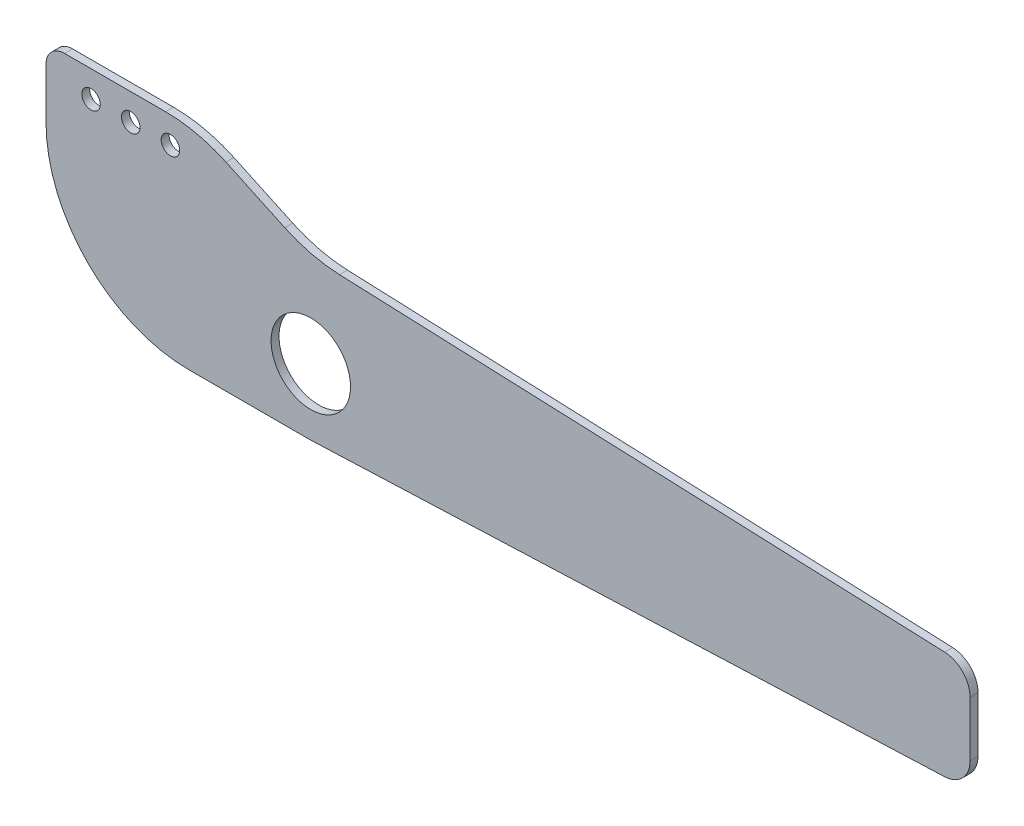
from build123d import *

# Parameters (mm, degrees)
BOSS_EXTRU_1_DEPTH      = 3
ESQUISSE2_R             = 15
ENL_V_MAT_EXTRU_1_DEPTH = 3
ESQUISSE3_W             = 100
ESQUISSE3_H             = 3
BOSS_EXTRU_2_DEPTH      = 20
ESQUISSE4_R             = 3.5
ENL_V_MAT_EXTRU_2_DEPTH = 3
ENL_V_MAT_EXTRU_3_DEPTH = 3
CONG_1_R                = 54
CONG_3_R                = 54
CONG_4_R                = 10
CONG_5_R                = 7


with BuildPart() as part:
    # Esquisse1 → Boss.-Extru.1 (new body)
    with BuildSketch(Plane.XY):
        Polygon((0, 0), (0, 60), (100, 60), (348.978261886, 50), (348.978261886, 10), (100, 0), align=None)
    extrude(amount=BOSS_EXTRU_1_DEPTH)

    # Esquisse2 → Enlèv. mat.-Extru.1 (cut)
    with BuildSketch(Plane.XY.offset(3)):
        with Locations((100, 25)):
            Circle(ESQUISSE2_R)
    extrude(amount=-ENL_V_MAT_EXTRU_1_DEPTH, mode=Mode.SUBTRACT)

    # Esquisse3 → Boss.-Extru.2 (add)
    with BuildSketch(Plane(origin=(0, 60, 0), x_dir=(1, 0, 0), z_dir=(0, 1, 0))):
        with Locations((50, -1.5)):
            Rectangle(ESQUISSE3_W, ESQUISSE3_H)
    extrude(amount=BOSS_EXTRU_2_DEPTH)

    # Esquisse4 → Enlèv. mat.-Extru.2 (cut)
    with BuildSketch(Plane.XY.offset(3)):
        with Locations((47, 70)):
            Circle(ESQUISSE4_R)
        with Locations((32, 70)):
            Circle(ESQUISSE4_R)
        with Locations((17, 70)):
            Circle(ESQUISSE4_R)
    extrude(amount=-ENL_V_MAT_EXTRU_2_DEPTH, mode=Mode.SUBTRACT)

    # Esquisse5 → Enlèv. mat.-Extru.3 (cut)
    with BuildSketch(Plane.XY.offset(3)):
        Polygon((100, 60), (57.10986159, 80), (100, 80), align=None)
    extrude(amount=-ENL_V_MAT_EXTRU_3_DEPTH, mode=Mode.SUBTRACT)

    # Congé1
    cong_1_edges = [part.edges().sort_by_distance(p)[0] for p in [
        (100, 60, 1.5),
        (57.10986159, 80, 1.5),
    ]]
    fillet(cong_1_edges, radius=CONG_1_R)

    # Congé3
    cong_3_edges = [part.edges().sort_by_distance(p)[0] for p in [
        (0, 0, 1.5),
    ]]
    fillet(cong_3_edges, radius=CONG_3_R)

    # Congé4
    cong_4_edges = [part.edges().sort_by_distance(p)[0] for p in [
        (348.978261886, 50, 1.5),
        (348.978261886, 10, 1.5),
    ]]
    fillet(cong_4_edges, radius=CONG_4_R)

    # Congé5
    cong_5_edges = [part.edges().sort_by_distance(p)[0] for p in [
        (0, 80, 1.5),
    ]]
    fillet(cong_5_edges, radius=CONG_5_R)


solid = part.part
